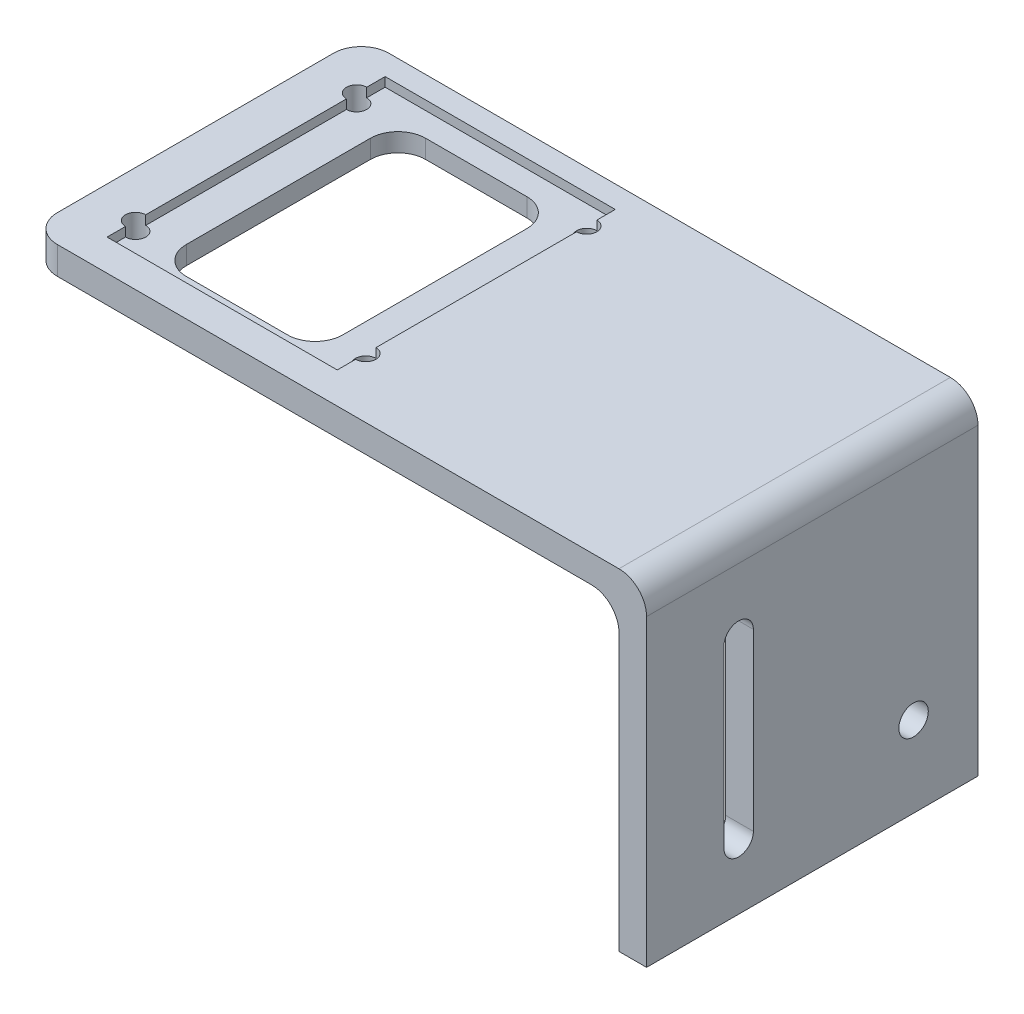
from build123d import *

# Parameters (mm, degrees)
EXTRUDE_1_DEPTH     = 36
SKETCH_2_R          = 1.1
SKETCH_2_W          = 17
SKETCH_2_H          = 26
CUT_EXTRUDE_1_DEPTH = 12
SKETCH_3_R          = 1.6
CUT_EXTRUDE_2_DEPTH = 22
FILLET_1_R          = 3
CUT_EXTRUDE_3_DEPTH = 1


with BuildPart() as part:
    # 草图1 → 凸台-拉伸1 (new body)
    with BuildSketch(Plane.XY):
        Polygon((0, 0), (67, 0), (67, -2), (67, -36), (64, -36), (64, -3), (0, -3), align=None)
    extrude(amount=EXTRUDE_1_DEPTH)

    # 草图2 → 切除-拉伸1 (cut)
    with BuildSketch(Plane(origin=(0, 0, 0), x_dir=(1, 0, 0), z_dir=(0, 1, 0))):
        with Locations(Location((5, -5.5, 0), (0, 0, 270))):
            Circle(SKETCH_2_R)
        with Locations(Location((5, -29.5, 0), (0, 0, 270))):
            Circle(SKETCH_2_R)
        with Locations(Location((30, -5.5, 0), (0, 0, 270))):
            Circle(SKETCH_2_R)
        with Locations(Location((30, -29.5, 0), (0, 0, 270))):
            Circle(SKETCH_2_R)
        with Locations((17.5, -18)):
            Rectangle(SKETCH_2_W, SKETCH_2_H)
    extrude(amount=-CUT_EXTRUDE_1_DEPTH, mode=Mode.SUBTRACT)

    # 草图3 → 切除-拉伸2 (cut)
    with BuildSketch(Plane.ZY.offset(-64)):
        with Locations(Location((7, -27.215224582, 0), (0, 0, 270))):
            Circle(SKETCH_3_R)
        with BuildLine():
            Line((27.6, -10), (27.6, -29))
            ThreePointArc((27.6, -29), (26, -30.6), (24.4, -29))
            Line((24.4, -29), (24.4, -10))
            ThreePointArc((24.4, -10), (26, -8.4), (27.6, -10))
        make_face()
    extrude(amount=-CUT_EXTRUDE_2_DEPTH, mode=Mode.SUBTRACT)

    # 圆角1
    fillet_1_edges = [part.edges().sort_by_distance(p)[0] for p in [
        (0, -1.5, 0),
        (67, 0, 18),
        (64, -3, 18),
        (9, -1.5, 31),
        (9, -1.5, 5),
        (26, -1.5, 5),
        (26, -1.5, 31),
        (0, -1.5, 36),
    ]]
    fillet(fillet_1_edges, radius=FILLET_1_R)

    # 草图4 → 切除-拉伸3 (cut)
    with BuildSketch(Plane(origin=(0, 0, 0), x_dir=(1, 0, 0), z_dir=(0, 1, 0))):
        Polygon((5, -4.4), (5, -30.6), (5, -32.6), (30, -32.6), (30, -30.6), (30, -4.4), (30, -2.4), (5, -2.4), align=None)
    extrude(amount=-CUT_EXTRUDE_3_DEPTH, mode=Mode.SUBTRACT)


solid = part.part
